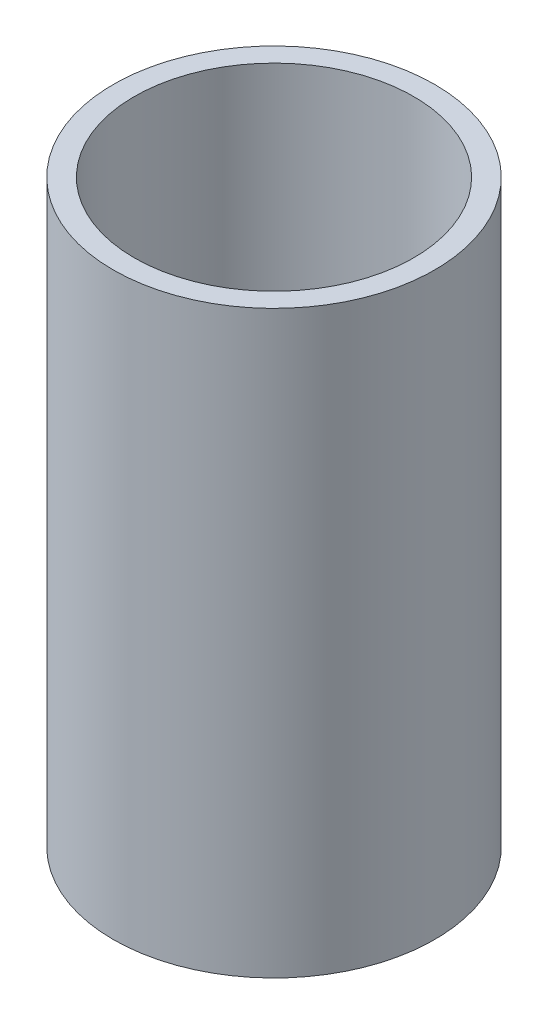
from build123d import *

# Parameters (mm, degrees)
SKETCH1_R           = 11.5
SKETCH1_R_2         = 10
BOSS_EXTRUDE1_DEPTH = 40
BOSS_EXTRUDE2_START = 1.5
SKETCH2_R           = 11.5
BOSS_EXTRUDE2_DEPTH = 1.5


with BuildPart() as part:
    # Sketch1 → Boss-Extrude1 (new body)
    with BuildSketch(Plane(origin=(0, 0, 0), x_dir=(1, 0, 0), z_dir=(0, 1, 0))):
        with Locations(Location((0, 0, 0), (0, 0, 270))):
            Circle(SKETCH1_R)
        with Locations(Location((0, 0, 0), (0, 0, 270))):
            Circle(SKETCH1_R_2, mode=Mode.SUBTRACT)
    extrude(amount=BOSS_EXTRUDE1_DEPTH)

    # Sketch2 → Boss-Extrude2 (add)
    with BuildSketch(Plane.XZ.offset(BOSS_EXTRUDE2_START)):
        with Locations(Location((0, 0, 0), (0, 0, 270))):
            Circle(SKETCH2_R)
    extrude(amount=-BOSS_EXTRUDE2_DEPTH)


solid = part.part
